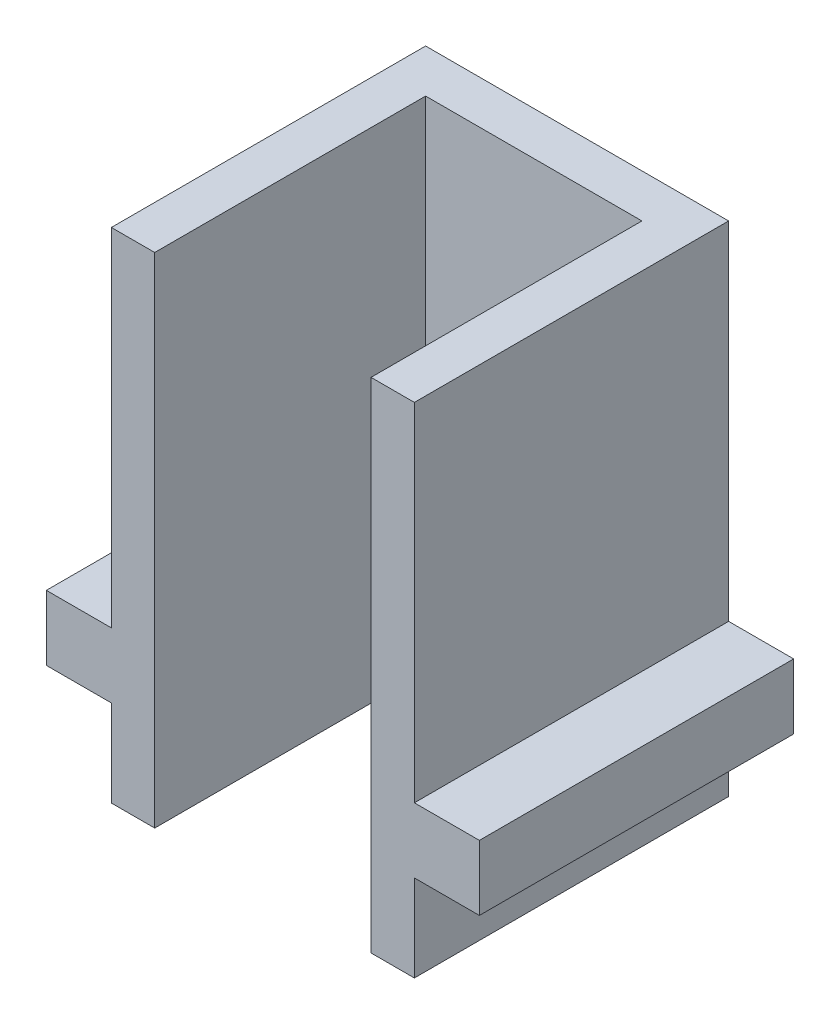
from build123d import *

# Parameters (mm, degrees)
BOSS_EXTRUDE1_DEPTH = 23
SKETCH9_W           = 14.5
SKETCH9_H           = 3
BOSS_EXTRUDE4_DEPTH = 3


with BuildPart() as part:
    # Sketch1 → Boss-Extrude1 (new body)
    with BuildSketch(Plane(origin=(0, 0, 0), x_dir=(1, 0, 0), z_dir=(0, 1, 0))):
        Polygon((-4.99, 0), (4.99, 0), (4.99, -12.5), (6.99, -12.5), (6.99, 2), (-6.99, 2), (-6.99, -12.5), (-4.99, -12.5), align=None)
    extrude(amount=BOSS_EXTRUDE1_DEPTH)

    # Sketch9 → Boss-Extrude4 (add)
    with BuildSketch(Plane.ZY.offset(6.99)):
        with Locations((5.25, 5.5)):
            Rectangle(SKETCH9_W, SKETCH9_H)
    boss_extrude4 = extrude(amount=BOSS_EXTRUDE4_DEPTH)

    # Mirror1: Boss-Extrude4 across plane
    add(boss_extrude4.mirror(Plane.ZY))


solid = part.part
